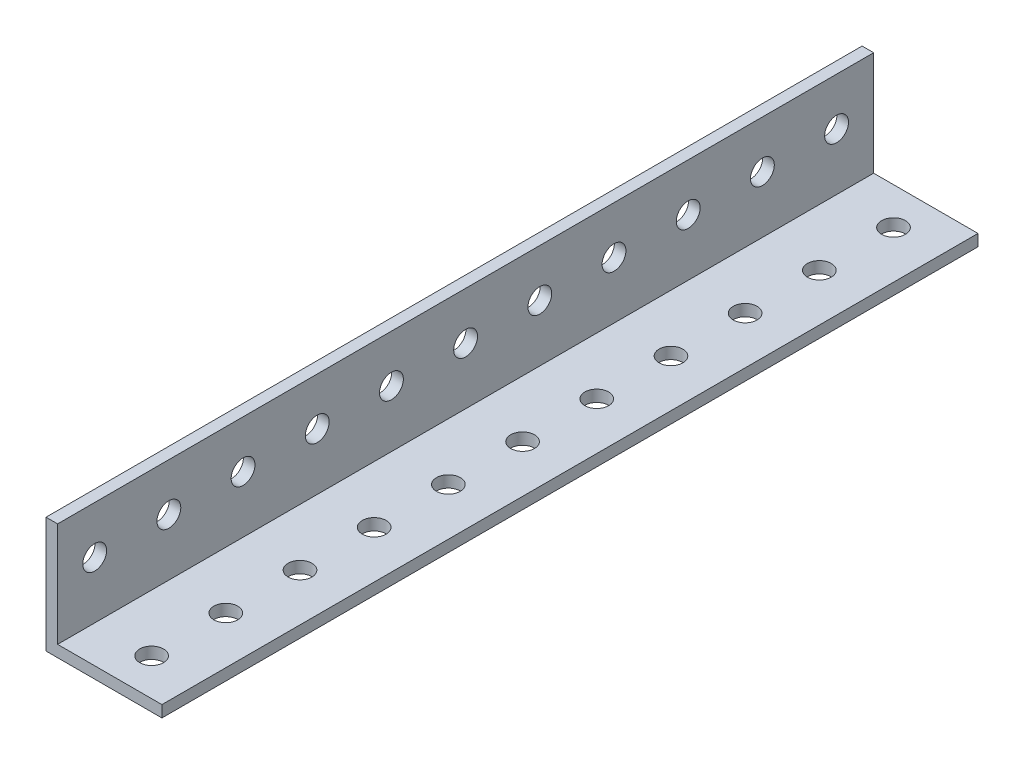
from build123d import *

# Parameters (mm, degrees)
EXTRUDE1_DEPTH      = 111.76
LPATTERN1_COUNT     = 6
LPATTERN1_PITCH     = 10.16
LPATTERN1_COL_COUNT = 6
LPATTERN1_COL_PITCH = 10.16
LPATTERN2_COUNT     = 6
LPATTERN2_PITCH     = 10.16
LPATTERN2_COL_COUNT = 6
LPATTERN2_COL_PITCH = 10.16


with BuildPart() as part:
    # Sketch1 → Extrude1 (new body)
    with BuildSketch(Plane.XY):
        Polygon((0, 0), (0, 15.875), (1.5875, 15.875), (1.5875, 1.5875), (15.875, 1.5875), (15.875, 0), align=None)
    extrude(amount=EXTRUDE1_DEPTH)

    # Sketch3 → #4 Clearance Hole1 (revolve, cut)
    with BuildSketch(Plane(origin=(9.3853, 1.5875, 55.88), x_dir=(0, 0, 1), z_dir=(1, 0, 0))):
        Polygon((0, 0), (0, 16.220574487), (1.63195, 15.24), (1.63195, 0), align=None)
    f_4_clearance_hole1 = revolve(axis=Axis((9.3853, 7.9375, 55.88), (0, -1, 0)), mode=Mode.SUBTRACT)

    # LPattern1: #4 Clearance Hole1 ×6
    with Locations(*[(0, 0, i * LPATTERN1_PITCH) for i in range(1, LPATTERN1_COUNT)]):
        add(f_4_clearance_hole1, mode=Mode.SUBTRACT)

    # LPattern1 col: #4 Clearance Hole1 ×6
    with Locations(*[(0, 0, -i * LPATTERN1_COL_PITCH) for i in range(1, LPATTERN1_COL_COUNT)]):
        add(f_4_clearance_hole1, mode=Mode.SUBTRACT)

    # Sketch5 → #4 Clearance Hole2 (revolve, cut)
    with BuildSketch(Plane(origin=(1.5875, 9.3726, 55.88), x_dir=(0, 0, -1), z_dir=(0, 1, 0))):
        Polygon((0, 0), (0, 16.220574487), (1.63195, 15.24), (1.63195, 0), align=None)
    f_4_clearance_hole2 = revolve(axis=Axis((7.9375, 9.3726, 55.88), (-1, 0, 0)), mode=Mode.SUBTRACT)

    # LPattern2: #4 Clearance Hole2 ×6
    with Locations(*[(0, 0, i * LPATTERN2_PITCH) for i in range(1, LPATTERN2_COUNT)]):
        add(f_4_clearance_hole2, mode=Mode.SUBTRACT)

    # LPattern2 col: #4 Clearance Hole2 ×6
    with Locations(*[(0, 0, -i * LPATTERN2_COL_PITCH) for i in range(1, LPATTERN2_COL_COUNT)]):
        add(f_4_clearance_hole2, mode=Mode.SUBTRACT)


solid = part.part
